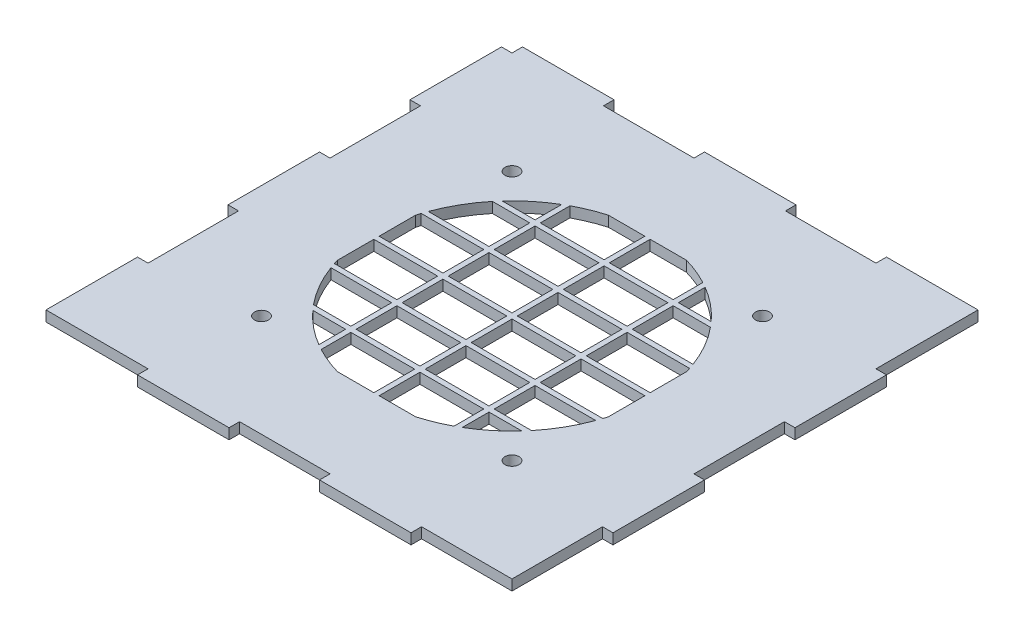
from build123d import *

# Parameters (mm, degrees)
BOSS_EXTRUDE1_DEPTH = 3
SKETCH2_W           = 130
SKETCH2_H           = 1.5
BOSS_EXTRUDE2_DEPTH = 3
SKETCH3_W           = 1.5
SKETCH3_H           = 11.641666667
SKETCH3_H_2         = 11.641666666
BOSS_EXTRUDE3_DEPTH = 3
SKETCH4_R           = 2
CUT_EXTRUDE1_DEPTH  = 97.213304693


with BuildPart() as part:
    # Sketch1 → Boss-Extrude1 (new body)
    with BuildSketch(Plane(origin=(0, 0, 0), x_dir=(1, 0, 0), z_dir=(0, 1, 0))):
        Polygon((65, 38.88), (68, 38.88), (68, 12.76), (65, 12.76), (65, -13.06), (68, -13.06), (68, -39.18), (65, -39.18), (65, -65), (39.18, -65), (39.18, -68), (13.06, -68), (13.06, -65), (-12.76, -65), (-12.76, -68), (-38.88, -68), (-38.88, -65), (-64.7, -65), (-68, -65), (-68, -38.88), (-65, -38.88), (-65, -13.06), (-68, -13.06), (-68, 13.06), (-65, 13.06), (-65, 38.88), (-68, 38.88), (-68, 65), (-65, 65), (-65, 68), (-38.88, 68), (-38.88, 65), (-13.06, 65), (-13.06, 68), (13.06, 68), (13.06, 65), (38.88, 65), (38.88, 68), (65, 68), (65, 64.7), align=None)
        with BuildLine():
            Line((11.149299305, -38.675), (-11.149299305, -38.675))
            ThreePointArc((-11.149299305, -38.675), (-28.461047943, -28.461047943), (-38.675, -11.149299305))
            Line((-38.675, -11.149299305), (-38.675, 11.149299305))
            ThreePointArc((-38.675, 11.149299305), (-28.461047943, 28.461047943), (-11.149299305, 38.675))
            Line((-11.149299305, 38.675), (11.149299305, 38.675))
            ThreePointArc((11.149299305, 38.675), (28.461047943, 28.461047943), (38.675, 11.149299305))
            Line((38.675, 11.149299305), (38.675, -11.149299305))
            ThreePointArc((38.675, -11.149299305), (28.461047943, -28.461047943), (11.149299305, -38.675))
        make_face(mode=Mode.SUBTRACT)
    extrude(amount=BOSS_EXTRUDE1_DEPTH)

    # Sketch2 → Boss-Extrude2 (add, through all)
    with BuildSketch(Plane(origin=(0, 3, 0), x_dir=(1, 0, 0), z_dir=(0, 1, 0))):
        with Locations((0, 39.425)):
            Rectangle(SKETCH2_W, SKETCH2_H)
        with Locations((0, 26.283333333)):
            Rectangle(SKETCH2_W, SKETCH2_H)
        with Locations((0, 13.141666667)):
            Rectangle(SKETCH2_W, SKETCH2_H)
        Rectangle(SKETCH2_W, SKETCH2_H)
        with Locations((0, -13.141666667)):
            Rectangle(SKETCH2_W, SKETCH2_H)
        with Locations((0, -26.283333333)):
            Rectangle(SKETCH2_W, SKETCH2_H)
        with Locations((0, -39.425)):
            Rectangle(SKETCH2_W, SKETCH2_H)
    extrude(amount=-BOSS_EXTRUDE2_DEPTH)

    # Sketch3 → Boss-Extrude3 (add, through all)
    with BuildSketch(Plane(origin=(0, 3, 0), x_dir=(1, 0, 0), z_dir=(0, 1, 0))):
        with Locations((-19.7125, -6.570833334)):
            Rectangle(SKETCH3_W, SKETCH3_H)
        with Locations((-19.7125, 6.570833334)):
            Rectangle(SKETCH3_W, SKETCH3_H)
        with Locations((-19.7125, -19.7125)):
            Rectangle(SKETCH3_W, SKETCH3_H_2)
        with Locations((0, -6.570833334)):
            Rectangle(SKETCH3_W, SKETCH3_H)
        with Locations((-19.7125, 19.7125)):
            Rectangle(SKETCH3_W, SKETCH3_H_2)
        with Locations((0, 6.570833334)):
            Rectangle(SKETCH3_W, SKETCH3_H)
        with BuildLine():
            Line((-18.9625, -27.033333333), (-20.4625, -27.033333333))
            Line((-20.4625, -27.033333333), (-20.4625, -34.66047596))
            ThreePointArc((-20.4625, -34.66047596), (-19.717004208, -35.089916573), (-18.9625, -35.503325108))
            Line((-18.9625, -35.503325108), (-18.9625, -27.033333333))
        make_face()
        with Locations((0, -19.7125)):
            Rectangle(SKETCH3_W, SKETCH3_H_2)
        with Locations((19.7125, -6.570833334)):
            Rectangle(SKETCH3_W, SKETCH3_H)
        with BuildLine():
            Line((-20.4625, 34.66047596), (-20.4625, 27.033333333))
            Line((-20.4625, 27.033333333), (-18.9625, 27.033333333))
            Line((-18.9625, 27.033333333), (-18.9625, 35.503325108))
            ThreePointArc((-18.9625, 35.503325108), (-19.717004208, 35.089916573), (-20.4625, 34.66047596))
        make_face()
        with Locations((0, 19.7125)):
            Rectangle(SKETCH3_W, SKETCH3_H_2)
        with Locations((19.7125, 6.570833334)):
            Rectangle(SKETCH3_W, SKETCH3_H)
        with Locations((0, -32.854166667)):
            Rectangle(SKETCH3_W, SKETCH3_H)
        with Locations((19.7125, -19.7125)):
            Rectangle(SKETCH3_W, SKETCH3_H_2)
        with Locations((0, 32.854166667)):
            Rectangle(SKETCH3_W, SKETCH3_H)
        with Locations((19.7125, 19.7125)):
            Rectangle(SKETCH3_W, SKETCH3_H_2)
        with BuildLine():
            Line((20.4625, -27.033333333), (18.9625, -27.033333333))
            Line((18.9625, -27.033333333), (18.9625, -35.503325108))
            ThreePointArc((18.9625, -35.503325108), (19.717004208, -35.089916573), (20.4625, -34.66047596))
            Line((20.4625, -34.66047596), (20.4625, -27.033333333))
        make_face()
        with BuildLine():
            Line((18.9625, 35.503325108), (18.9625, 27.033333333))
            Line((18.9625, 27.033333333), (20.4625, 27.033333333))
            Line((20.4625, 27.033333333), (20.4625, 34.66047596))
            ThreePointArc((20.4625, 34.66047596), (19.717004208, 35.089916573), (18.9625, 35.503325108))
        make_face()
    extrude(amount=-BOSS_EXTRUDE3_DEPTH)

    # Sketch4 → Cut-Extrude1 (cut, through all)
    with BuildSketch(Plane(origin=(0, 3, 0), x_dir=(1, 0, 0), z_dir=(0, 1, 0))):
        with Locations(Location((-35.75, 35.75, 0), (0, 0, 270))):
            Circle(SKETCH4_R)
        with Locations(Location((35.75, 35.75, 0), (0, 0, 270))):
            Circle(SKETCH4_R)
        with Locations(Location((35.75, -35.75, 0), (0, 0, 270))):
            Circle(SKETCH4_R)
        with Locations(Location((-35.75, -35.75, 0), (0, 0, 270))):
            Circle(SKETCH4_R)
    extrude(amount=-CUT_EXTRUDE1_DEPTH, mode=Mode.SUBTRACT)


solid = part.part
